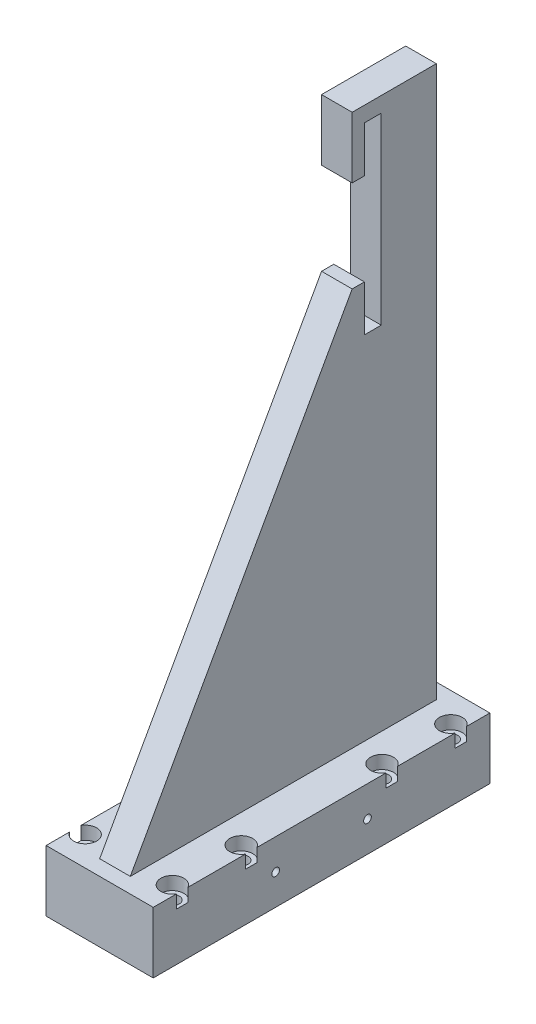
from build123d import *

# Parameters (mm, degrees)
SKETCH_1_W                  = 70
SKETCH_1_H                  = 220
EXTRUDE_1_DEPTH             = 40
HOLE_WIZARD_M81_D           = 9
HOLE_WIZARD_M81_CBORE_D     = 15
HOLE_WIZARD_M81_CBORE_DEPTH = 8.6
EXTRUDE_2_DEPTH             = 10
HOLE_WIZARD_M61_D           = 5


with BuildPart() as part:
    # Эскиз1 → Бобышка-Вытянуть1 (new body)
    with BuildSketch(Plane(origin=(0, 0, 0), x_dir=(1, 0, 0), z_dir=(0, 1, 0))):
        Rectangle(SKETCH_1_W, SKETCH_1_H)
    extrude(amount=EXTRUDE_1_DEPTH)

    # Цековка для  винта с внутренним шестигранником M81 (through all)
    with Locations(Plane(origin=(0, 40, 0), x_dir=(1, 0, 0), z_dir=(0, 1, 0))):
        with Locations((-28.5, -46), (28.5, -46), (28.5, -91), (-28.5, -91)):
            hole_wizard_m81 = CounterBoreHole(HOLE_WIZARD_M81_D / 2, HOLE_WIZARD_M81_CBORE_D / 2, HOLE_WIZARD_M81_CBORE_DEPTH)

    # Зеркальное отражение1: Цековка для  винта с внутренним шестигранником M81 across plane
    add(hole_wizard_m81.mirror(Plane.XY), mode=Mode.SUBTRACT)

    # Эскиз4 → Бобышка-Вытянуть2 (add, symmetric)
    with BuildSketch(Plane(origin=(0, 0, 0), x_dir=(0, 0, -1), z_dir=(1, 0, 0))):
        Polygon((100, 40), (100, 400), (45, 400), (45, 360), (53, 360), (53, 390), (64, 390), (64, 270), (53, 270), (53, 300), (45, 300), (-100, 40), align=None)
    extrude(amount=EXTRUDE_2_DEPTH, both=True)

    # Отверстие обработанное метчиком M61 (through all)
    with Locations(Plane(origin=(35, 0, 0), x_dir=(0, 0, -1), z_dir=(1, 0, 0))):
        with Locations((-30, 20), (30, 20)):
            Hole(HOLE_WIZARD_M61_D / 2)


solid = part.part
